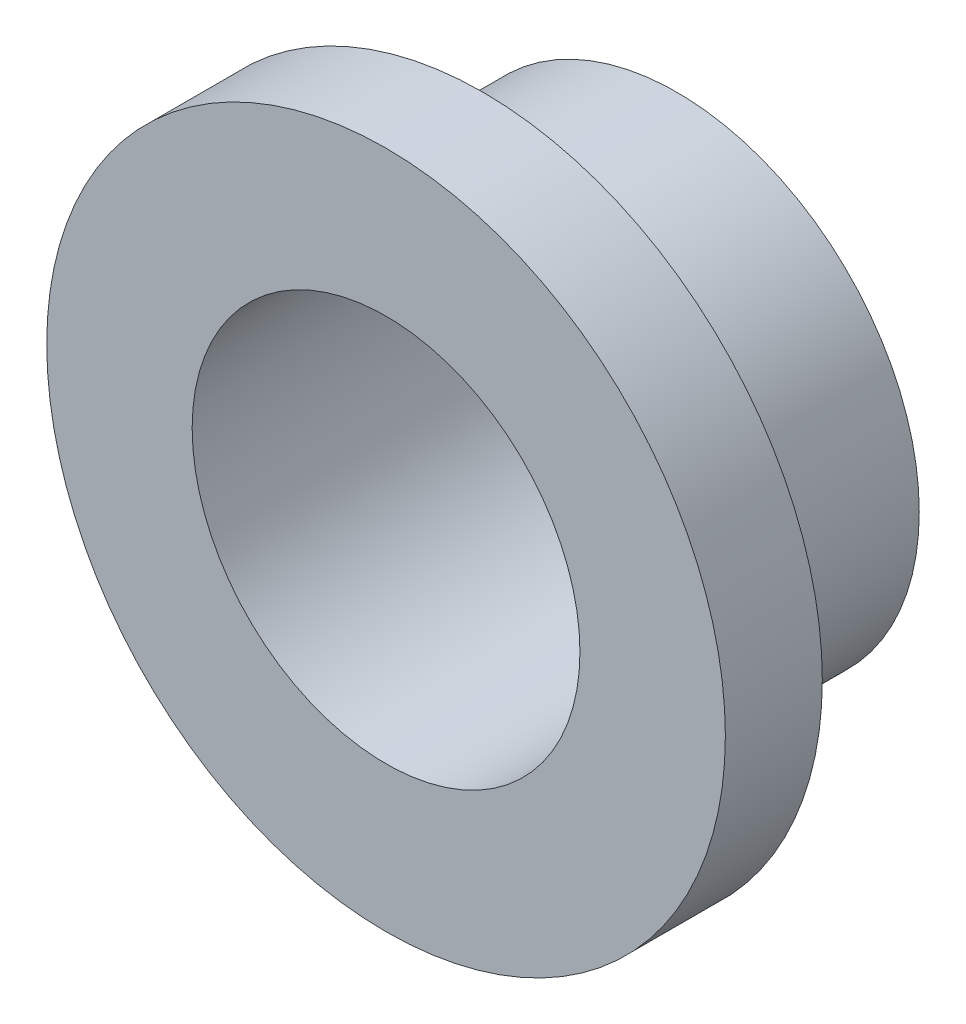
from build123d import *

# Parameters (mm, degrees)
SKETCH1_R           = 7.9375
SKETCH1_R_2         = 6.35
BOSS_EXTRUDE1_DEPTH = 9.525
BOSS_EXTRUDE2_START = -3.175
SKETCH2_R           = 11.1125
SKETCH2_R_2         = 6.35
BOSS_EXTRUDE2_DEPTH = 3.175


with BuildPart() as part:
    # Sketch1 → Boss-Extrude1 (new body)
    with BuildSketch(Plane.XY):
        with Locations(Location((0, 0, 0), (0, 0, 180))):
            Circle(SKETCH1_R)
        with Locations(Location((0, 0, 0), (0, 0, 180))):
            Circle(SKETCH1_R_2, mode=Mode.SUBTRACT)
    extrude(amount=BOSS_EXTRUDE1_DEPTH)

    # Sketch2 → Boss-Extrude2 (add)
    with BuildSketch(Plane.XY.offset(9.525).offset(BOSS_EXTRUDE2_START)):
        Circle(SKETCH2_R)
        with Locations(Location((0, 0, 0), (0, 0, 180))):
            Circle(SKETCH2_R_2, mode=Mode.SUBTRACT)
    extrude(amount=BOSS_EXTRUDE2_DEPTH)


solid = part.part
